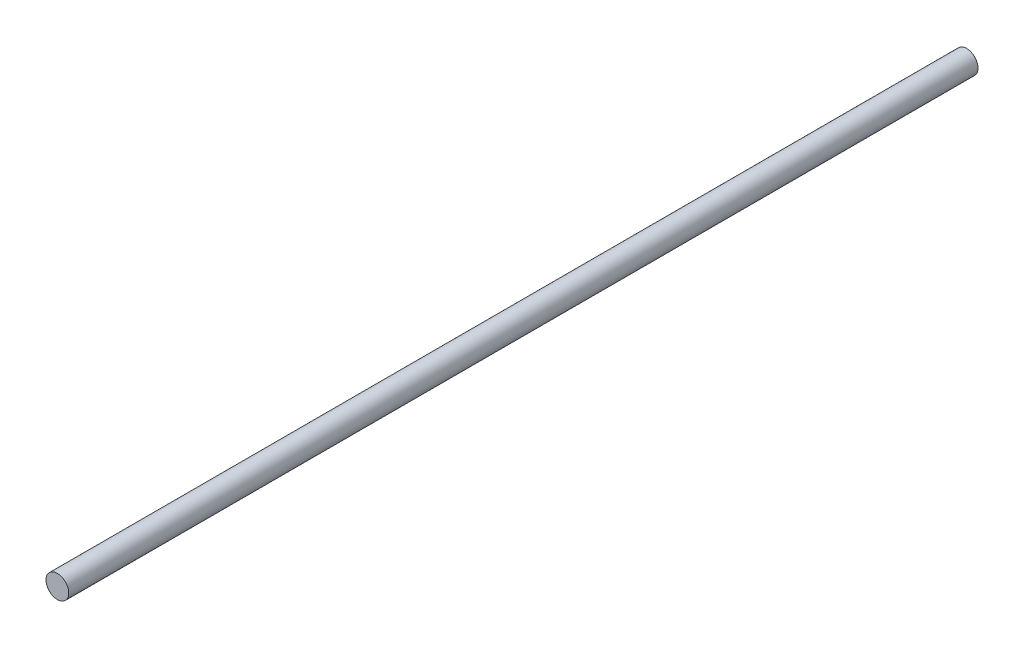
from build123d import *

# Parameters (mm, degrees)
SKETCH1_R           = 3.81
BOSS_EXTRUDE1_DEPTH = 304.8


with BuildPart() as part:
    # Sketch1 → Boss-Extrude1 (new body)
    with BuildSketch(Plane.XY):
        with Locations(Location((0, 0, 0), (0, 0, 180))):
            Circle(SKETCH1_R)
    extrude(amount=BOSS_EXTRUDE1_DEPTH)


solid = part.part
